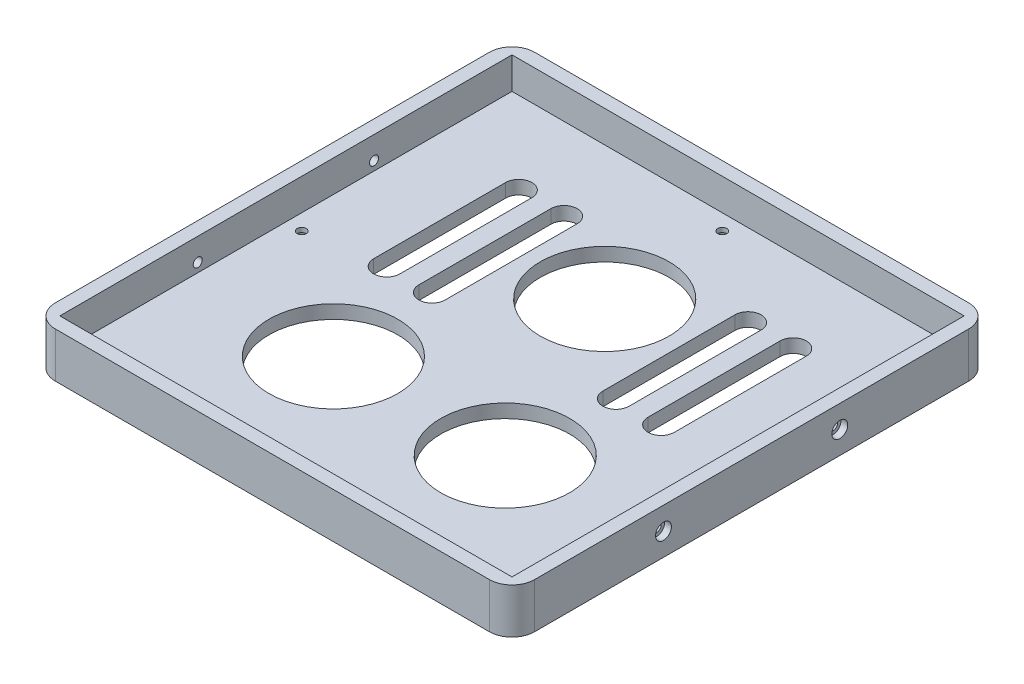
from build123d import *

# Parameters (mm, degrees)
SKETCH1_W           = 106
SKETCH1_H           = 106
BOSS_EXTRUDE1_DEPTH = 10
SKETCH3_W           = 100
SKETCH3_H           = 100
CUT_EXTRUDE5_DEPTH  = 7
SKETCH7_R           = 14.25
CUT_EXTRUDE6_DEPTH  = 7
SKETCH9_R           = 1.75
CUT_EXTRUDE7_DEPTH  = 2
SKETCH11_R          = 1
CUT_EXTRUDE8_DEPTH  = 17
CUT_EXTRUDE9_DEPTH  = 1.5
SKETCH14_R          = 1
CUT_EXTRUDE10_DEPTH = 115.5
CUT_EXTRUDE11_START = -1.5
SKETCH15_R          = 1.75
CUT_EXTRUDE11_DEPTH = 1.5
FILLET1_R           = 5
CUT_EXTRUDE12_DEPTH = 10


with BuildPart() as part:
    # Sketch1 → Boss-Extrude1 (new body)
    with BuildSketch(Plane(origin=(0, 0, 0), x_dir=(1, 0, 0), z_dir=(0, 1, 0))):
        Rectangle(SKETCH1_W, SKETCH1_H)
    extrude(amount=BOSS_EXTRUDE1_DEPTH)

    # Sketch3 → Cut-Extrude5 (cut)
    with BuildSketch(Plane(origin=(0, 10, 0), x_dir=(1, 0, 0), z_dir=(0, 1, 0))):
        Rectangle(SKETCH3_W, SKETCH3_H)
    extrude(amount=-CUT_EXTRUDE5_DEPTH, mode=Mode.SUBTRACT)

    # Sketch7 → Cut-Extrude6 (cut)
    with BuildSketch(Plane(origin=(0, 3, 0), x_dir=(1, 0, 0), z_dir=(0, 1, 0))):
        with Locations(Location((0, 20.5, 0), (0, 0, 270))):
            Circle(SKETCH7_R)
        with Locations(Location((19, -20.5, 0), (0, 0, 270))):
            Circle(SKETCH7_R)
        with Locations(Location((-19, -20.5, 0), (0, 0, 270))):
            Circle(SKETCH7_R)
    extrude(amount=-CUT_EXTRUDE6_DEPTH, mode=Mode.SUBTRACT)

    # Sketch9 → Cut-Extrude7 (cut)
    with BuildSketch(Plane.XZ):
        with Locations(Location((46.5, 0, 0), (0, 0, 270))):
            Circle(SKETCH9_R)
        with Locations(Location((0, -46.5, 0), (0, 0, 270))):
            Circle(SKETCH9_R)
        with Locations(Location((0, 46.5, 0), (0, 0, 270))):
            Circle(SKETCH9_R)
        with Locations(Location((-46.5, 0, 0), (0, 0, 270))):
            Circle(SKETCH9_R)
    extrude(amount=-CUT_EXTRUDE7_DEPTH, mode=Mode.SUBTRACT)

    # Sketch11 → Cut-Extrude8 (cut)
    with BuildSketch(Plane.XZ.offset(-2)):
        with Locations(Location((46.5, 0, 0), (0, 0, 270))):
            Circle(SKETCH11_R)
        with Locations(Location((0, -46.5, 0), (0, 0, 270))):
            Circle(SKETCH11_R)
        with Locations(Location((-46.5, 0, 0), (0, 0, 270))):
            Circle(SKETCH11_R)
        with Locations(Location((0, 46.5, 0), (0, 0, 270))):
            Circle(SKETCH11_R)
    extrude(amount=-CUT_EXTRUDE8_DEPTH, mode=Mode.SUBTRACT)

    # Sketch12 → Cut-Extrude9 (cut)
    with BuildSketch(Plane(origin=(53, 0, 0), x_dir=(0, 0, -1), z_dir=(1, 0, 0))):
        with BuildLine():
            ThreePointArc((-17.75, 5), (-18.262563133, 6.237436867), (-19.5, 6.75))
            Line((-19.5, 6.75), (-19.5, 3.25))
            ThreePointArc((-19.5, 3.25), (-18.262563133, 3.762563133), (-17.75, 5))
        make_face()
        with BuildLine():
            Line((-19.5, 3.25), (-19.5, 6.75))
            ThreePointArc((-19.5, 6.75), (-21.25, 5), (-19.5, 3.25))
        make_face()
        with BuildLine():
            ThreePointArc((21.25, 5), (20.737436867, 6.237436867), (19.5, 6.75))
            Line((19.5, 6.75), (19.5, 3.25))
            ThreePointArc((19.5, 3.25), (20.737436867, 3.762563133), (21.25, 5))
        make_face()
        with BuildLine():
            Line((19.5, 3.25), (19.5, 6.75))
            ThreePointArc((19.5, 6.75), (17.75, 5), (19.5, 3.25))
        make_face()
    extrude(amount=-CUT_EXTRUDE9_DEPTH, mode=Mode.SUBTRACT)

    # Sketch14 → Cut-Extrude10 (cut)
    with BuildSketch(Plane(origin=(51.5, 0, 0), x_dir=(0, 0, -1), z_dir=(1, 0, 0))):
        with Locations((-19.5, 5)):
            Circle(SKETCH14_R)
        with Locations((19.5, 5)):
            Circle(SKETCH14_R)
    extrude(amount=-CUT_EXTRUDE10_DEPTH, mode=Mode.SUBTRACT)

    # Sketch15 → Cut-Extrude11 (cut)
    with BuildSketch(Plane.ZY.offset(53).offset(CUT_EXTRUDE11_START)):
        with Locations(Location((-19.5, 5, 0), (0, 0, 180))):
            Circle(SKETCH15_R)
        with Locations(Location((19.5, 5, 0), (0, 0, 180))):
            Circle(SKETCH15_R)
    extrude(amount=CUT_EXTRUDE11_DEPTH, mode=Mode.SUBTRACT)

    # Fillet1
    fillet1_edges = [part.edges().sort_by_distance(p)[0] for p in [
        (53, 5, 53),
        (-53, 5, 53),
        (-53, 5, -53),
        (53, 5, -53),
    ]]
    fillet(fillet1_edges, radius=FILLET1_R)

    # Sketch21 → Cut-Extrude12 (cut)
    with BuildSketch(Plane.XZ):
        with BuildLine():
            Line((-33.25, -31.84554788), (-33.25, -2.65445212))
            ThreePointArc((-33.25, -2.65445212), (-30.34554788, 0.25), (-27.441095759, -2.65445212))
            Line((-27.441095759, -2.65445212), (-27.441095759, -31.84554788))
            ThreePointArc((-27.441095759, -31.84554788), (-30.34554788, -34.75), (-33.25, -31.84554788))
        make_face()
        with BuildLine():
            Line((-23.25, -31.84554788), (-23.25, -2.65445212))
            ThreePointArc((-23.25, -2.65445212), (-20.34554788, 0.25), (-17.441095759, -2.65445212))
            Line((-17.441095759, -2.65445212), (-17.441095759, -31.84554788))
            ThreePointArc((-17.441095759, -31.84554788), (-20.34554788, -34.75), (-23.25, -31.84554788))
        make_face()
        with BuildLine():
            ThreePointArc((33.25, -31.84554788), (30.34554788, -34.75), (27.441095759, -31.84554788))
            Line((27.441095759, -31.84554788), (27.441095759, -2.65445212))
            ThreePointArc((27.441095759, -2.65445212), (30.34554788, 0.25), (33.25, -2.65445212))
            Line((33.25, -2.65445212), (33.25, -31.84554788))
        make_face()
        with BuildLine():
            Line((23.25, -31.84554788), (23.25, -2.65445212))
            ThreePointArc((23.25, -2.65445212), (20.34554788, 0.25), (17.441095759, -2.65445212))
            Line((17.441095759, -2.65445212), (17.441095759, -31.84554788))
            ThreePointArc((17.441095759, -31.84554788), (20.34554788, -34.75), (23.25, -31.84554788))
        make_face()
    extrude(amount=-CUT_EXTRUDE12_DEPTH, mode=Mode.SUBTRACT)


solid = part.part
